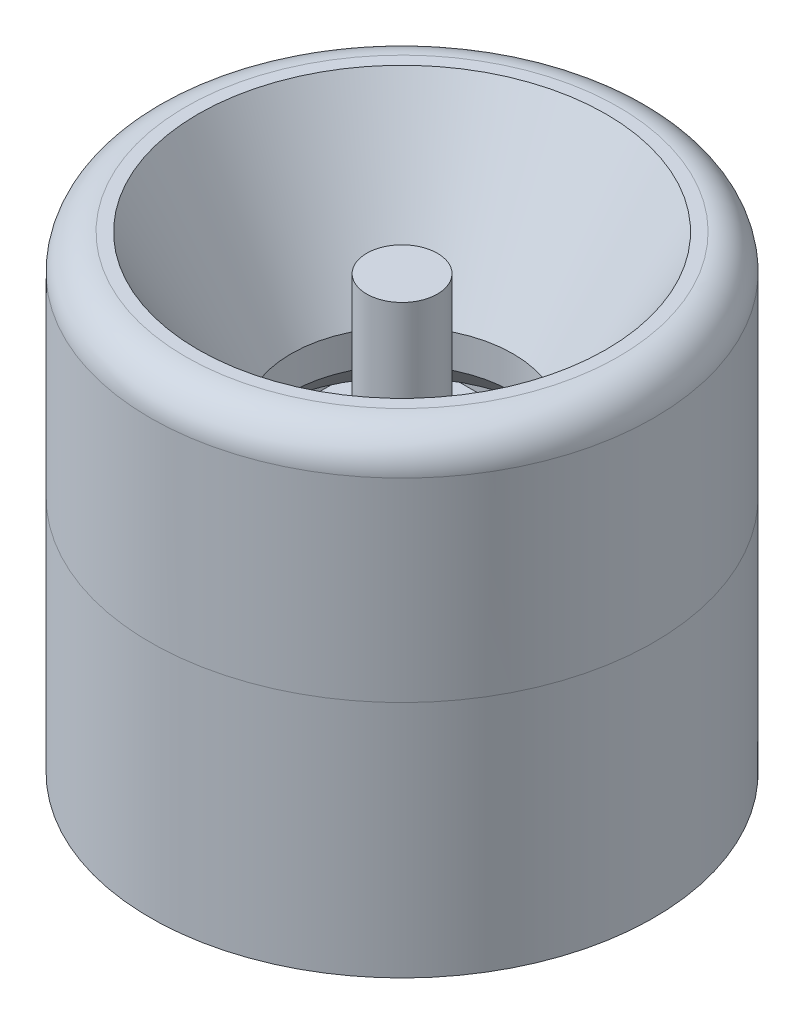
from build123d import *

# Parameters (mm, degrees)
SKETCH_1_W          = 16.5
SKETCH_1_H          = 15.4
SKETCH_1_R          = 0.5
EXTRUDE_1_DEPTH     = 7.5
SKETCH_2_W          = 12
SKETCH_2_H          = 2.7
EXTRUDE_2_DEPTH     = 2
SKETCH_3_W          = 12
SKETCH_3_H          = 0.5
EXTRUDE_3_DEPTH     = 6
SKETCH_4_R          = 2
EXTRUDE_4_DEPTH     = 11.45
SKETCH_6_R          = 14.25
SKETCH_6_W          = 16.9
SKETCH_6_H          = 15.8
EXTRUDE_5_DEPTH     = 8
SKETCH_8_R          = 14.25
EXTRUDE_6_DEPTH     = 5.5
SKETCH_7_W          = 13
SKETCH_7_H          = 2.6
CUT_EXTRUDE_2_DEPTH = 13
FILLET_1_R          = 0.5
SKETCH_9_R          = 1.65
CUT_EXTRUDE_3_DEPTH = 7
SKETCH_11_W         = 2.5
SKETCH_11_H         = 7
SKETCH_11_W_2       = 7
SKETCH_11_H_2       = 2.5
CUT_EXTRUDE_4_DEPTH = 5
SKETCH_12_W         = 1.5
SKETCH_12_H         = 4
SKETCH_12_W_2       = 4
SKETCH_12_H_2       = 1.5
CUT_EXTRUDE_5_DEPTH = 7
SKETCH_13_R         = 14.25
EXTRUDE_8_DEPTH     = 13
SKETCH_15_R         = 6.282732918
CUT_EXTRUDE_6_DEPTH = 15
FILLET_2_R          = 2
SKETCH_16_W         = 2.26
SKETCH_16_H         = 6.76
SKETCH_16_W_2       = 6.76
SKETCH_16_H_2       = 2.26
EXTRUDE_9_DEPTH     = 4
FILLET_3_R          = 0.8
SKETCH_17_R         = 4
CUT_EXTRUDE_7_DEPTH = 13.5
CHAMFER_1_SIZE      = 2


with BuildPart() as part:
    # 草图1 → 凸台-拉伸1 (new body)
    with BuildSketch(Plane(origin=(0, 0, 0), x_dir=(1, 0, 0), z_dir=(0, 1, 0))):
        with Locations((0.25, 0.05)):
            Rectangle(SKETCH_1_W, SKETCH_1_H)
        with Locations(Location((0, 0, 0), (0, 0, 270))):
            Circle(SKETCH_1_R, mode=Mode.SUBTRACT)
    extrude(amount=EXTRUDE_1_DEPTH)

    # 草图2 → 凸台-拉伸2 (add)
    with BuildSketch(Plane.XZ):
        with Locations((2.5, 9)):
            Rectangle(SKETCH_2_W, SKETCH_2_H)
    extrude(amount=-EXTRUDE_2_DEPTH)

    # 草图3 → 凸台-拉伸3 (add)
    with BuildSketch(Plane(origin=(0, 2, 0), x_dir=(1, 0, 0), z_dir=(0, 1, 0))):
        with Locations((2.5, -10.1)):
            Rectangle(SKETCH_3_W, SKETCH_3_H)
    extrude(amount=-EXTRUDE_3_DEPTH)

    # 草图4 → 凸台-拉伸4 (add)
    with BuildSketch(Plane(origin=(0, 7.5, 0), x_dir=(1, 0, 0), z_dir=(0, 1, 0))):
        with Locations(Location((0, 0, 0), (0, 0, 270))):
            Circle(SKETCH_4_R)
    extrude(amount=EXTRUDE_4_DEPTH)

    # 草图5 → 旋转1 (revolve)
    with BuildSketch(Plane.XY):
        with BuildLine():
            Line((0, 9), (5.137119816, 9))
            ThreePointArc((5.137119816, 9), (5.780256002, 7.508925279), (6, 5.9))
            Line((6, 5.9), (0, 5.9))
            Line((0, 5.9), (0, 9))
        make_face()
    revolve(axis=Axis((0, 0, 0), (0, 1, 0)))


with BuildPart() as body_2:
    # 草图6 → 凸台-拉伸5 (new body)
    with BuildSketch(Plane.XZ):
        with Locations(Location((0, 0, 0), (0, 0, 270))):
            Circle(SKETCH_6_R)
        with Locations((0.25, -0.05)):
            Rectangle(SKETCH_6_W, SKETCH_6_H, mode=Mode.SUBTRACT)
    extrude(amount=-EXTRUDE_5_DEPTH)

    # 草图8 → 凸台-拉伸6 (add)
    with BuildSketch(Plane.XZ):
        with Locations(Location((0, 0, 0), (0, 0, 270))):
            Circle(SKETCH_8_R)
    extrude(amount=EXTRUDE_6_DEPTH)

    # 草图7 → 切除-拉伸2 (cut)
    with BuildSketch(Plane.XZ.offset(-8)):
        with Locations((2.2, 9.15)):
            Rectangle(SKETCH_7_W, SKETCH_7_H)
    extrude(amount=CUT_EXTRUDE_2_DEPTH, mode=Mode.SUBTRACT)

    # 圆角1
    fillet_1_edges = [body_2.edges().sort_by_distance(p)[0] for p in [
        (8.7, 1.5, 10.45),
    ]]
    fillet(fillet_1_edges, radius=FILLET_1_R)

    # 草图9 → 切除-拉伸3 (cut)
    with BuildSketch(Plane.XZ.offset(5.5)):
        with Locations(Location((11, 0, 0), (0, 0, 270))):
            Circle(SKETCH_9_R)
        with Locations(Location((-11, 0, 0), (0, 0, 90))):
            Circle(SKETCH_9_R)
    extrude(amount=-CUT_EXTRUDE_3_DEPTH, mode=Mode.SUBTRACT)

    # 草图11 → 切除-拉伸4 (cut)
    with BuildSketch(Plane(origin=(0, 8, 0), x_dir=(1, 0, 0), z_dir=(0, 1, 0))):
        with Locations((-11.3, 0)):
            Rectangle(SKETCH_11_W, SKETCH_11_H)
        with Locations((11.3, 0)):
            Rectangle(SKETCH_11_W, SKETCH_11_H)
        with Locations((0, 11.3)):
            Rectangle(SKETCH_11_W_2, SKETCH_11_H_2)
    extrude(amount=-CUT_EXTRUDE_4_DEPTH, mode=Mode.SUBTRACT)

    # 草图12 → 切除-拉伸5 (cut)
    with BuildSketch(Plane(origin=(0, 0, 0), x_dir=(1, 0, 0), z_dir=(0, 1, 0))):
        with Locations((7.95, 0.05)):
            Rectangle(SKETCH_12_W, SKETCH_12_H)
        with Locations((0.25, 7.2)):
            Rectangle(SKETCH_12_W_2, SKETCH_12_H_2)
        with Locations((-7.45, 0.05)):
            Rectangle(SKETCH_12_W, SKETCH_12_H)
    extrude(amount=-CUT_EXTRUDE_5_DEPTH, mode=Mode.SUBTRACT)

    # 草图17 → 切除-拉伸7 (cut)
    with BuildSketch(Plane.XZ.offset(5.5)):
        with Locations(Location((0, 0, 0), (0, 0, 270))):
            Circle(SKETCH_17_R)
    extrude(amount=-CUT_EXTRUDE_7_DEPTH, mode=Mode.SUBTRACT)


with BuildPart() as body_3:
    # 草图13 → 凸台-拉伸8 (new body)
    with BuildSketch(Plane(origin=(0, 8, 0), x_dir=(1, 0, 0), z_dir=(0, 1, 0))):
        with Locations(Location((0, 0, 0), (0, 0, 90))):
            Circle(SKETCH_13_R)
    extrude(amount=EXTRUDE_8_DEPTH)

    # 草图14 → 切除-旋转1 (revolve, cut)
    with BuildSketch(Plane.XY, mode=Mode.PRIVATE) as cut_revolve_1_sk:
        Polygon((0, 1), (13.735073412, 24.789844995), (0, 24.789844995), align=None)
    revolve(cut_revolve_1_sk.sketch.rotate(Axis((0, 24.789844995, 0), (0, -1, 0)), 90), axis=Axis((0, 24.789844995, 0), (0, -1, 0)), mode=Mode.SUBTRACT)

    # 草图15 → 切除-拉伸6 (cut)
    with BuildSketch(Plane.XZ.offset(-8)):
        with Locations(Location((0, 0, 0), (0, 0, 270))):
            Circle(SKETCH_15_R)
    extrude(amount=-CUT_EXTRUDE_6_DEPTH, mode=Mode.SUBTRACT)

    # 圆角2
    fillet_2_edges = [body_3.edges().sort_by_distance(p)[0] for p in [
        (0, 21, 14.25),
    ]]
    fillet(fillet_2_edges, radius=FILLET_2_R)

    # 草图16 → 凸台-拉伸9 (add)
    with BuildSketch(Plane.XZ.offset(-8)):
        with Locations((-11.3, 0)):
            Rectangle(SKETCH_16_W, SKETCH_16_H)
        with Locations((11.3, 0)):
            Rectangle(SKETCH_16_W, SKETCH_16_H)
        with Locations((0, -11.3)):
            Rectangle(SKETCH_16_W_2, SKETCH_16_H_2)
    extrude(amount=EXTRUDE_9_DEPTH)

    # 圆角3
    fillet_3_edges = [body_3.edges().sort_by_distance(p)[0] for p in [
        (-10.17, 6, -3.38),
        (-10.17, 6, 3.38),
        (-12.43, 6, 3.38),
        (-12.43, 6, -3.38),
        (10.17, 6, -3.38),
        (12.43, 6, -3.38),
        (12.43, 6, 3.38),
        (10.17, 6, 3.38),
        (-3.38, 6, -12.43),
        (3.38, 6, -12.43),
        (3.38, 6, -10.17),
        (-3.38, 6, -10.17),
    ]]
    fillet(fillet_3_edges, radius=FILLET_3_R)

    # 倒角1
    chamfer_1_edges = [body_3.edges().sort_by_distance(p)[0] for p in [
        (0, 8, 6.282732918),
    ]]
    chamfer(chamfer_1_edges, length=CHAMFER_1_SIZE)


solid = Compound([part.part, body_2.part, body_3.part])
